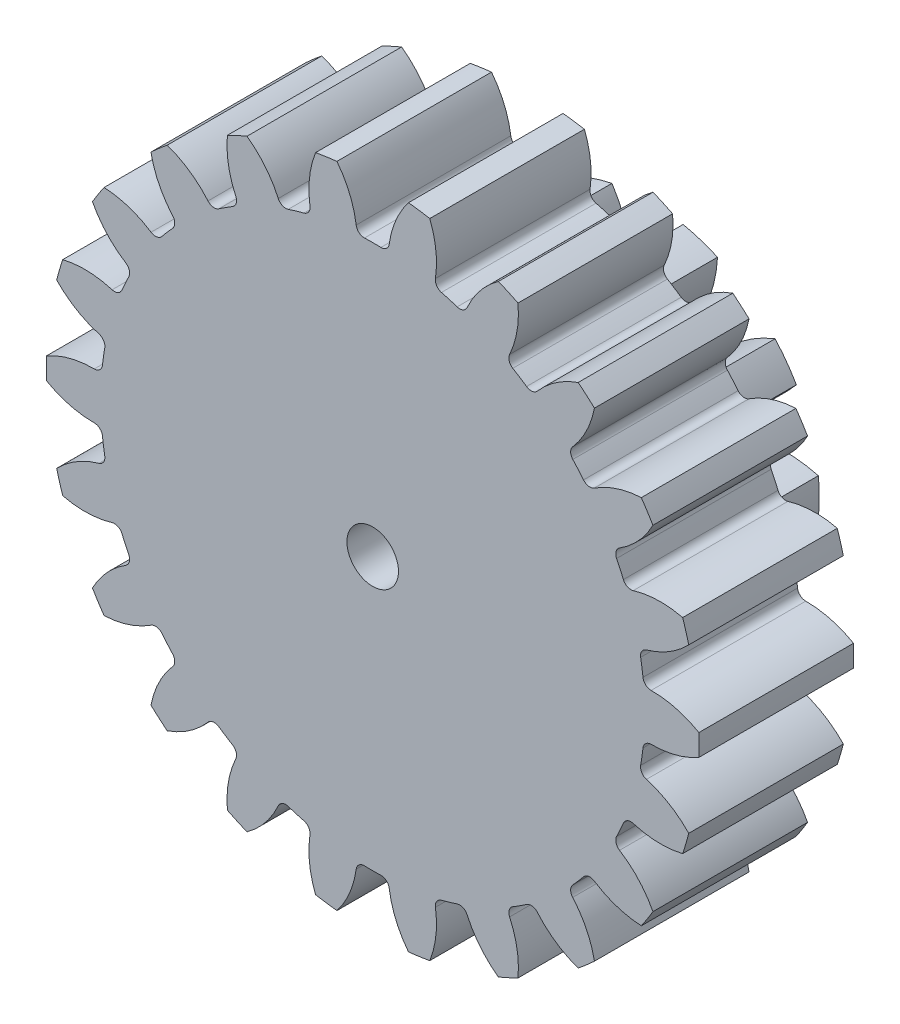
from build123d import *

# Parameters (mm, degrees)
SKETCH1_R                = 10
BOSS_EXTRUDE1_DEPTH      = 3.5
CUT_EXTRUDE1_DEPTH       = 15.568802284
FILLET2_R                = 0.5
CIRPATTERN1_COUNT        = 10
FILLET2_OF_CIRPATTERN1_R = 0.5
SKETCH4_R                = 19
BOSS_EXTRUDE2_DEPTH      = 9
CUT_EXTRUDE2_DEPTH       = 9
FILLET3_R                = 0.475
CIRPATTERN2_COUNT        = 22
FILLET3_OF_CIRPATTERN2_R = 0.475
SKETCH6_R                = 1.5
CUT_EXTRUDE3_DEPTH       = 32.203588464


with BuildPart() as part:
    # Sketch1 → Boss-Extrude1 (new, symmetric)
    with BuildSketch(Plane.XY):
        Circle(SKETCH1_R)
    extrude(amount=BOSS_EXTRUDE1_DEPTH, both=True)

    # Sketch3 → Cut-Extrude1 (cut, symmetric)
    with BuildSketch(Plane.XY):
        with BuildLine():
            ThreePointArc((-2.721939872, 10.657909895), (-1.519639498, 8.762901035), (-0.90177966, 6.605394605))
            ThreePointArc((-0.90177966, 6.605394605), (0, 6.666666667), (0.90177966, 6.605394605))
            ThreePointArc((0.90177966, 6.605394605), (1.519639498, 8.762901035), (2.721939872, 10.657909895))
            ThreePointArc((2.721939872, 10.657909895), (0, 11), (-2.721939872, 10.657909895))
        make_face()
    cut_extrude1 = extrude(amount=CUT_EXTRUDE1_DEPTH, both=True, mode=Mode.SUBTRACT)

    # Fillet2
    fillet2_edges = [part.edges().sort_by_distance(p)[0] for p in [
        (-0.90177966, 6.605394605, 0),
        (0.90177966, 6.605394605, 0),
    ]]
    fillet(fillet2_edges, radius=FILLET2_R)

    # CirPattern1: Cut-Extrude1 ×10 about axis
    cirpattern1_axis = Axis((0, 0, 0), (0, 0, 1))
    for i in range(1, CIRPATTERN1_COUNT):
        add(cut_extrude1.rotate(cirpattern1_axis, i * 360 / CIRPATTERN1_COUNT), mode=Mode.SUBTRACT)

    # Fillet2 of CirPattern1
    fillet2_of_cirpattern1_edges = [part.edges().sort_by_distance(p)[0] for p in [
        (-4.612108605, 4.813823705, 0),
        (-3.152998464, 5.873929275, 0),
        (-6.560768822, 1.183535765, 0),
        (-6.003438342, 2.89882261, 0),
        (-6.003438342, -2.89882261, 0),
        (-6.560768822, -1.183535765, 0),
        (-3.152998464, -5.873929275, 0),
        (-4.612108605, -4.813823705, 0),
        (0.90177966, -6.605394605, 0),
        (-0.90177966, -6.605394605, 0),
        (4.612108605, -4.813823705, 0),
        (3.152998464, -5.873929275, 0),
        (6.560768822, -1.183535765, 0),
        (6.003438342, -2.89882261, 0),
        (6.003438342, 2.89882261, 0),
        (6.560768822, 1.183535765, 0),
        (3.152998464, 5.873929275, 0),
        (4.612108605, 4.813823705, 0),
    ]]
    fillet(fillet2_of_cirpattern1_edges, radius=FILLET2_OF_CIRPATTERN1_R)


with BuildPart() as body_2:
    # Sketch4 → Boss-Extrude2 (new body)
    with BuildSketch(Plane.XY.offset(3.5)):
        Circle(SKETCH4_R)
    extrude(amount=BOSS_EXTRUDE2_DEPTH)

    # Sketch5 → Cut-Extrude2 (cut)
    with BuildSketch(Plane.XY.offset(12.5)):
        with BuildLine():
            ThreePointArc((-2.963435866, 19.779232742), (-1.520960757, 18.00924871), (-0.919276345, 15.806624417))
            ThreePointArc((-0.919276345, 15.806624417), (0, 15.833333333), (0.919276345, 15.806624417))
            ThreePointArc((0.919276345, 15.806624417), (1.520960757, 18.00924871), (2.963435866, 19.779232742))
            ThreePointArc((2.963435866, 19.779232742), (0, 20), (-2.963435866, 19.779232742))
        make_face()
    cut_extrude2 = extrude(amount=-CUT_EXTRUDE2_DEPTH, mode=Mode.SUBTRACT)

    # Fillet3
    fillet3_edges = [body_2.edges().sort_by_distance(p)[0] for p in [
        (-0.919276345, 15.806624417, 8),
        (0.919276345, 15.806624417, 8),
    ]]
    fillet(fillet3_edges, radius=FILLET3_R)

    # CirPattern2: Cut-Extrude2 ×22 about axis
    cirpattern2_axis = Axis((0, 0, 0), (0, 0, 1))
    for i in range(1, CIRPATTERN2_COUNT):
        add(cut_extrude2.rotate(cirpattern2_axis, i * 360 / CIRPATTERN2_COUNT), mode=Mode.SUBTRACT)

    # Fillet3 of CirPattern2
    fillet3_of_cirpattern2_edges = [body_2.edges().sort_by_distance(p)[0] for p in [
        (-5.335279906, 14.907354989, 8),
        (-3.571201518, 15.425335139, 8),
        (-9.319050819, 12.800380318, 8),
        (-7.772361873, 13.794376947, 8),
        (-12.547847657, 9.65639496, 8),
        (-11.343851693, 11.045880373, 8),
        (-14.760092503, 5.730105911, 8),
        (-13.996330113, 7.402512264, 8),
        (-15.776562436, 1.33959776, 8),
        (-15.514909107, 3.159436635, 8),
        (-15.514909107, -3.159436635, 8),
        (-15.776562436, -1.33959776, 8),
        (-13.996330113, -7.402512264, 8),
        (-14.760092503, -5.730105911, 8),
        (-11.343851693, -11.045880373, 8),
        (-12.547847657, -9.65639496, 8),
        (-7.772361873, -13.794376947, 8),
        (-9.319050819, -12.800380318, 8),
        (-3.571201518, -15.425335139, 8),
        (-5.335279906, -14.907354989, 8),
        (0.919276345, -15.806624417, 8),
        (-0.919276345, -15.806624417, 8),
        (5.335279906, -14.907354989, 8),
        (3.571201518, -15.425335139, 8),
        (9.319050819, -12.800380318, 8),
        (7.772361873, -13.794376947, 8),
        (12.547847657, -9.65639496, 8),
        (11.343851693, -11.045880373, 8),
        (14.760092503, -5.730105911, 8),
        (13.996330113, -7.402512264, 8),
        (15.776562436, -1.33959776, 8),
        (15.514909107, -3.159436635, 8),
        (15.514909107, 3.159436635, 8),
        (15.776562436, 1.33959776, 8),
        (13.996330113, 7.402512264, 8),
        (14.760092503, 5.730105911, 8),
        (11.343851693, 11.045880373, 8),
        (12.547847657, 9.65639496, 8),
        (7.772361873, 13.794376947, 8),
        (9.319050819, 12.800380318, 8),
        (3.571201518, 15.425335139, 8),
        (5.335279906, 14.907354989, 8),
    ]]
    fillet(fillet3_of_cirpattern2_edges, radius=FILLET3_OF_CIRPATTERN2_R)


with BuildPart() as cut_extrude3_tool:
    # Sketch6 → Cut-Extrude3 (new, through all)
    with BuildSketch(Plane.XY.offset(12.5)):
        Circle(SKETCH6_R)
    extrude(amount=-CUT_EXTRUDE3_DEPTH)


with BuildPart() as part_1:
    add(part.part)

    # Cut-Extrude3: cut by cut_extrude3_tool
    add(cut_extrude3_tool.part, mode=Mode.SUBTRACT)


with BuildPart() as body_2_1:
    add(body_2.part)

    # Cut-Extrude3: cut by cut_extrude3_tool
    add(cut_extrude3_tool.part, mode=Mode.SUBTRACT)


solid = Compound([part_1.part, body_2_1.part])
